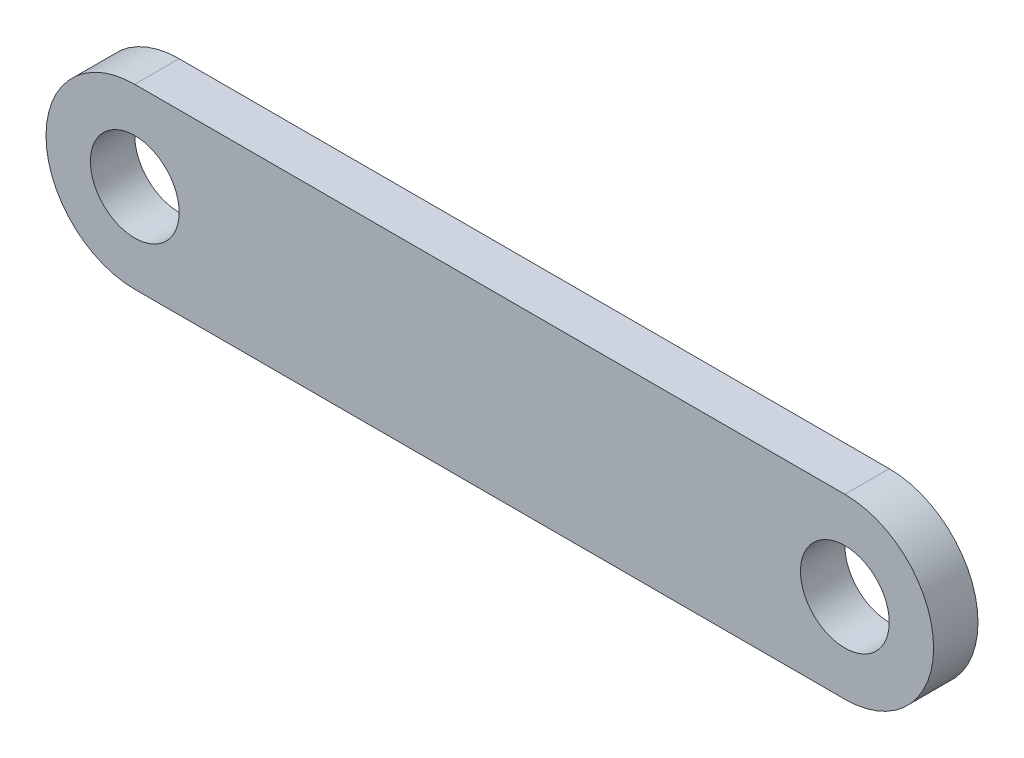
from build123d import *

# Parameters (mm, degrees)
SKETCH_1_R      = 10
EXTRUDE_1_DEPTH = 10


with BuildPart() as part:
    # 草图1 → 凸台-拉伸1 (new body)
    with BuildSketch(Plane.XY):
        with BuildLine():
            Line((-44.308348852, 47.000949508), (115.691651148, 47.000949508))
            ThreePointArc((115.691651148, 47.000949508), (135.691651148, 27.000949508), (115.691651148, 7.000949508))
            Line((115.691651148, 7.000949508), (-44.308348852, 7.000949508))
            ThreePointArc((-44.308348852, 7.000949508), (-64.308348852, 27.000949508), (-44.308348852, 47.000949508))
        make_face()
        with Locations((115.691651148, 27.000949508)):
            Circle(SKETCH_1_R, mode=Mode.SUBTRACT)
        with Locations((-44.308348852, 27.000949508)):
            Circle(SKETCH_1_R, mode=Mode.SUBTRACT)
    extrude(amount=EXTRUDE_1_DEPTH)


solid = part.part
